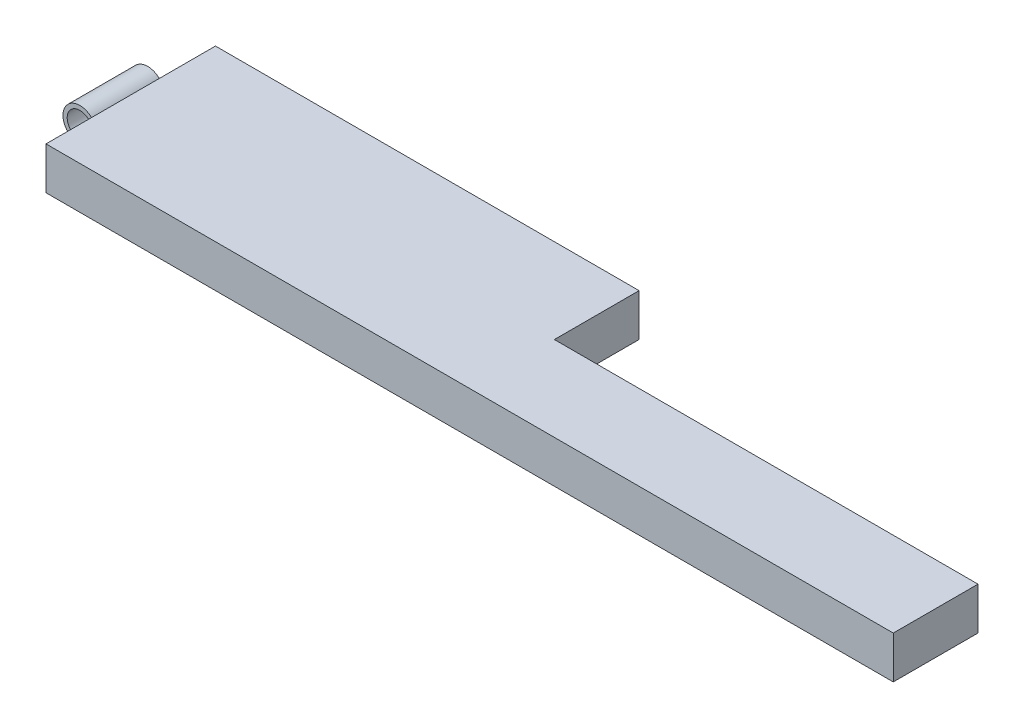
from build123d import *

# Parameters (mm, degrees)
BOSS_EXTRUDE1_DEPTH      = 6.35
BOSS_EXTRUDE2_DEPTH      = 5.08
BOSS_EXTRUDE2_DEPTH_BACK = 5.08
SKETCH2_R                = 2.54
SKETCH2_R_2              = 1.905


with BuildPart() as part:
    # Sketch1 → Boss-Extrude1 (new body)
    with BuildSketch(Plane(origin=(0, 0, 0), x_dir=(1, 0, 0), z_dir=(0, 1, 0))):
        Polygon((63.5, 25.4), (63.5, 12.7), (127, 12.7), (127, 0), (0, 0), (0, 25.4), align=None)
    extrude(amount=BOSS_EXTRUDE1_DEPTH)


with BuildPart() as body_2:
    # Sketch2 → Boss-Extrude2 (new, two sides: drawn at the far end of the back side and taken through both)
    with BuildSketch(Plane.XY.offset(-12.7).offset(-BOSS_EXTRUDE2_DEPTH_BACK)):
        with Locations((-2.54, 3.712588247)):
            Circle(SKETCH2_R)
        with Locations((-2.54, 3.712588247)):
            Circle(SKETCH2_R_2, mode=Mode.SUBTRACT)
    extrude(amount=BOSS_EXTRUDE2_DEPTH + BOSS_EXTRUDE2_DEPTH_BACK)


solid = Compound([part.part, body_2.part])
